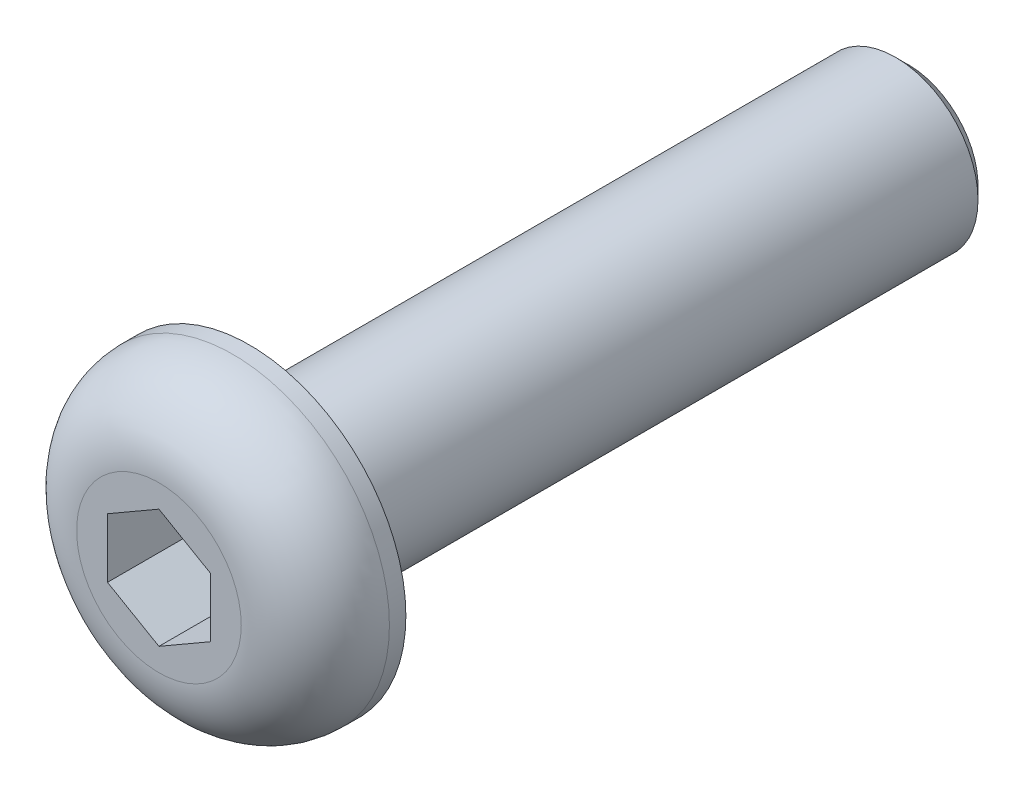
from build123d import *

# Parameters (mm, degrees)
SKETCH1_R           = 3.8
BOSS_EXTRUDE1_DEPTH = 2.2
SKETCH2_R           = 2
BOSS_EXTRUDE2_DEPTH = 16
CHAMFER1_SIZE       = 0.3
CUT_EXTRUDE1_DEPTH  = 2
FILLET1_R           = 1.8


with BuildPart() as part:
    # Sketch1 → Boss-Extrude1 (new body)
    with BuildSketch(Plane.XY):
        Circle(SKETCH1_R)
    extrude(amount=BOSS_EXTRUDE1_DEPTH)

    # Sketch2 → Boss-Extrude2 (add)
    with BuildSketch(Plane(origin=(0, 0, 0), x_dir=(-1, 0, 0), z_dir=(0, 0, -1))):
        with Locations(Location((0, 0, 0), (0, 0, 180))):
            Circle(SKETCH2_R)
    extrude(amount=BOSS_EXTRUDE2_DEPTH)

    # Chamfer1
    chamfer1_edges = [part.edges().sort_by_distance(p)[0] for p in [
        (-2, 0, -16),
    ]]
    chamfer(chamfer1_edges, length=CHAMFER1_SIZE)

    # Sketch3 → Cut-Extrude1 (cut)
    with BuildSketch(Plane.XY.offset(2.2)):
        Polygon((0, 1.443375673), (-1.25, 0.721687836), (-1.25, -0.721687836), (0, -1.443375673), (1.25, -0.721687836), (1.25, 0.721687836), align=None)
    extrude(amount=-CUT_EXTRUDE1_DEPTH, mode=Mode.SUBTRACT)

    # Fillet1
    fillet1_edges = [part.edges().sort_by_distance(p)[0] for p in [
        (-3.8, 0, 2.2),
    ]]
    fillet(fillet1_edges, radius=FILLET1_R)


solid = part.part
